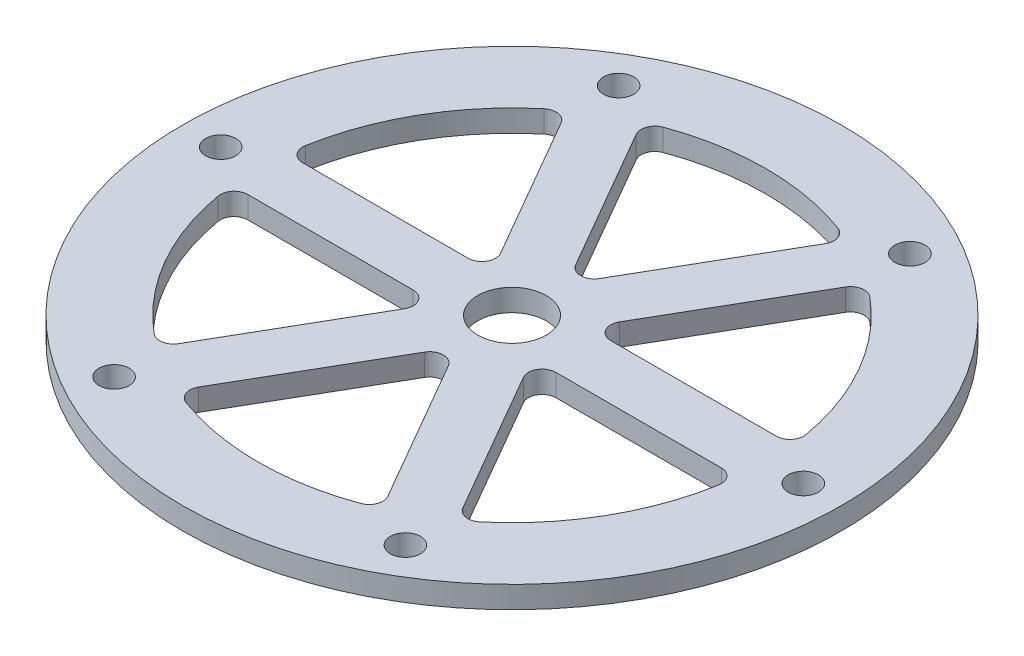
from build123d import *

# Parameters (mm, degrees)
SKETCH1_R           = 24
SKETCH1_R_2         = 1.1
BOSS_EXTRUDE1_DEPTH = 1.6
FILLET1_R           = 1
SKETCH2_R           = 2.5
CUT_EXTRUDE1_DEPTH  = 34.978816931


with BuildPart() as part:
    # Sketch1 → Boss-Extrude1 (new body)
    with BuildSketch(Plane(origin=(0, 0, 0), x_dir=(1, 0, 0), z_dir=(0, 1, 0))):
        with Locations(Location((0, 0, 0), (0, 0, 270))):
            Circle(SKETCH1_R)
        with BuildLine():
            Line((-7.463736271, -16.927570436), (0, -4))
            Line((0, -4), (7.463736271, -16.927570436))
            ThreePointArc((7.463736271, -16.927570436), (0, -18.5), (-7.463736271, -16.927570436))
        make_face(mode=Mode.SUBTRACT)
        with BuildLine():
            Line((10.927837886, -14.927570436), (3.464101615, -2))
            Line((3.464101615, -2), (18.391574158, -2))
            ThreePointArc((18.391574158, -2), (16.02146997, -9.25), (10.927837886, -14.927570436))
        make_face(mode=Mode.SUBTRACT)
        with BuildLine():
            Line((18.391574158, 2), (3.464101615, 2))
            Line((3.464101615, 2), (10.927837886, 14.927570436))
            ThreePointArc((10.927837886, 14.927570436), (16.02146997, 9.25), (18.391574158, 2))
        make_face(mode=Mode.SUBTRACT)
        with BuildLine():
            Line((7.463736271, 16.927570436), (0, 4))
            Line((0, 4), (-7.463736271, 16.927570436))
            ThreePointArc((-7.463736271, 16.927570436), (0, 18.5), (7.463736271, 16.927570436))
        make_face(mode=Mode.SUBTRACT)
        with BuildLine():
            Line((-10.927837886, 14.927570436), (-3.464101615, 2))
            Line((-3.464101615, 2), (-18.391574158, 2))
            ThreePointArc((-18.391574158, 2), (-16.02146997, 9.25), (-10.927837886, 14.927570436))
        make_face(mode=Mode.SUBTRACT)
        with BuildLine():
            Line((-18.391574158, -2), (-3.464101615, -2))
            Line((-3.464101615, -2), (-10.927837886, -14.927570436))
            ThreePointArc((-10.927837886, -14.927570436), (-16.02146997, -9.25), (-18.391574158, -2))
        make_face(mode=Mode.SUBTRACT)
        with Locations(Location((-10.60675, -18.371429903, 0), (0, 0, 270))):
            Circle(SKETCH1_R_2, mode=Mode.SUBTRACT)
        with Locations(Location((-21.2135, 0, 0), (0, 0, 270))):
            Circle(SKETCH1_R_2, mode=Mode.SUBTRACT)
        with Locations(Location((10.60675, -18.371429903, 0), (0, 0, 270))):
            Circle(SKETCH1_R_2, mode=Mode.SUBTRACT)
        with Locations(Location((21.2135, 0, 0), (0, 0, 270))):
            Circle(SKETCH1_R_2, mode=Mode.SUBTRACT)
        with Locations(Location((-10.60675, 18.371429903, 0), (0, 0, 270))):
            Circle(SKETCH1_R_2, mode=Mode.SUBTRACT)
        with Locations(Location((10.60675, 18.371429903, 0), (0, 0, 270))):
            Circle(SKETCH1_R_2, mode=Mode.SUBTRACT)
    extrude(amount=BOSS_EXTRUDE1_DEPTH)

    # Fillet1
    fillet1_edges = [part.edges().sort_by_distance(p)[0] for p in [
        (-3.464101615, 0.8, 2),
        (-18.391574158, 0.8, 2),
        (-10.927837886, 0.8, 14.927570436),
        (-18.391574158, 0.8, -2),
        (-3.464101615, 0.8, -2),
        (-10.927837886, 0.8, -14.927570436),
        (-7.463736271, 0.8, 16.927570436),
        (7.463736271, 0.8, 16.927570436),
        (0, 0.8, 4),
        (10.927837886, 0.8, 14.927570436),
        (18.391574158, 0.8, 2),
        (3.464101615, 0.8, 2),
        (18.391574158, 0.8, -2),
        (10.927837886, 0.8, -14.927570436),
        (3.464101615, 0.8, -2),
        (7.463736271, 0.8, -16.927570436),
        (-7.463736271, 0.8, -16.927570436),
        (0, 0.8, -4),
    ]]
    fillet(fillet1_edges, radius=FILLET1_R)

    # Sketch2 → Cut-Extrude1 (cut, through all)
    with BuildSketch(Plane(origin=(0, 1.6, 0), x_dir=(1, 0, 0), z_dir=(0, 1, 0))):
        with Locations(Location((0, 0, 0), (0, 0, 270))):
            Circle(SKETCH2_R)
    extrude(amount=-CUT_EXTRUDE1_DEPTH, mode=Mode.SUBTRACT)


solid = part.part
